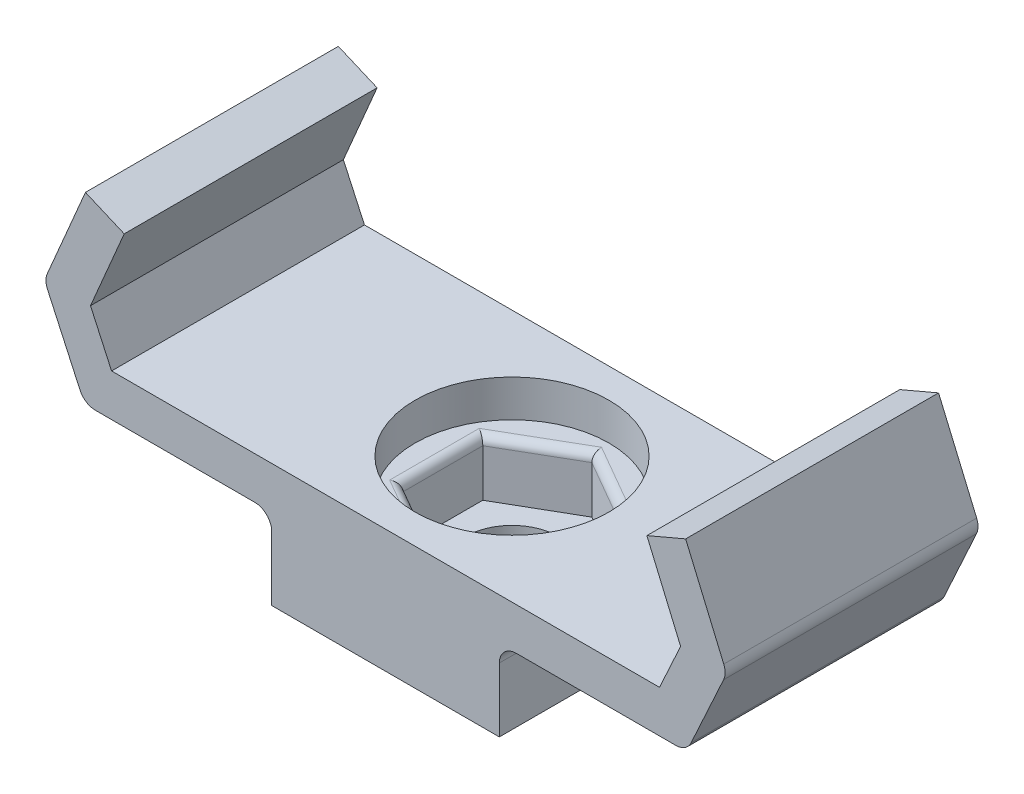
from build123d import *

# Parameters (mm, degrees)
BOSS_EXTRUDE1_DEPTH = 15
SKETCH4_W           = 13.5
SKETCH4_H           = 15
BOSS_EXTRUDE2_DEPTH = 4.8
CUT_EXTRUDE1_DEPTH  = 5.5
SKETCH6_R           = 5.75
CUT_EXTRUDE2_DEPTH  = 2.2
SKETCH7_R           = 2.75
CUT_EXTRUDE3_DEPTH  = 1.8
FILLET1_R           = 1
FILLET2_R           = 0.5


with BuildPart() as part:
    # Sketch1 → Boss-Extrude1 (new body)
    with BuildSketch(Plane.XY):
        Polygon((0, -2.5), (0, 0), (-16.25, 0), (-17.5, 2.727178029), (-15.5, 7.418659671), (-17.799745903, 8.399051828), (-20.233306637, 2.690549074), (-17.85422237, -2.5), align=None)
        Polygon((17.5, 2.727178029), (16.25, 0), (0, 0), (0, -2.5), (17.85422237, -2.5), (20.233306637, 2.690549074), (17.799745903, 8.399051828), (15.5, 7.418659671), align=None)
    extrude(amount=BOSS_EXTRUDE1_DEPTH)

    # Sketch4 → Boss-Extrude2 (add)
    with BuildSketch(Plane.XZ.offset(2.5)):
        with Locations((0, 7.5)):
            Rectangle(SKETCH4_W, SKETCH4_H)
    extrude(amount=BOSS_EXTRUDE2_DEPTH)

    # Sketch5 → Cut-Extrude1 (cut)
    with BuildSketch(Plane(origin=(0, 0, 0), x_dir=(1, 0, 0), z_dir=(0, 1, 0))):
        Polygon((-4.1, -9.867136104), (0, -12.234272207), (4.1, -9.867136104), (4.1, -5.132863896), (0, -2.765727793), (-4.1, -5.132863896), align=None)
    extrude(amount=-CUT_EXTRUDE1_DEPTH, mode=Mode.SUBTRACT)

    # Sketch6 → Cut-Extrude2 (cut)
    with BuildSketch(Plane(origin=(0, 0, 0), x_dir=(1, 0, 0), z_dir=(0, 1, 0))):
        with Locations(Location((0, -7.5, 0), (0, 0, 180))):
            Circle(SKETCH6_R)
    extrude(amount=-CUT_EXTRUDE2_DEPTH, mode=Mode.SUBTRACT)

    # Sketch7 → Cut-Extrude3 (cut)
    with BuildSketch(Plane(origin=(0, -5.5, 0), x_dir=(1, 0, 0), z_dir=(0, 1, 0))):
        with Locations(Location((0, -7.5, 0), (0, 0, 180))):
            Circle(SKETCH7_R)
    extrude(amount=-CUT_EXTRUDE3_DEPTH, mode=Mode.SUBTRACT)

    # Fillet1
    fillet1_edges = [part.edges().sort_by_distance(p)[0] for p in [
        (-17.85422237, -2.5, 7.5),
        (-20.233306637, 2.690549074, 7.5),
        (20.233306637, 2.690549074, 7.5),
        (17.85422237, -2.5, 7.5),
        (-6.75, -2.5, 7.5),
        (6.75, -2.5, 7.5),
    ]]
    fillet(fillet1_edges, radius=FILLET1_R)

    # Fillet2
    fillet2_edges = [part.edges().sort_by_distance(p)[0] for p in [
        (-2.05, -2.2, 11.050704156),
        (-4.1, -2.2, 7.5),
        (-2.05, -2.2, 3.949295844),
        (2.05, -2.2, 3.949295844),
        (4.1, -2.2, 7.5),
        (2.05, -2.2, 11.050704156),
    ]]
    fillet(fillet2_edges, radius=FILLET2_R)


solid = part.part
